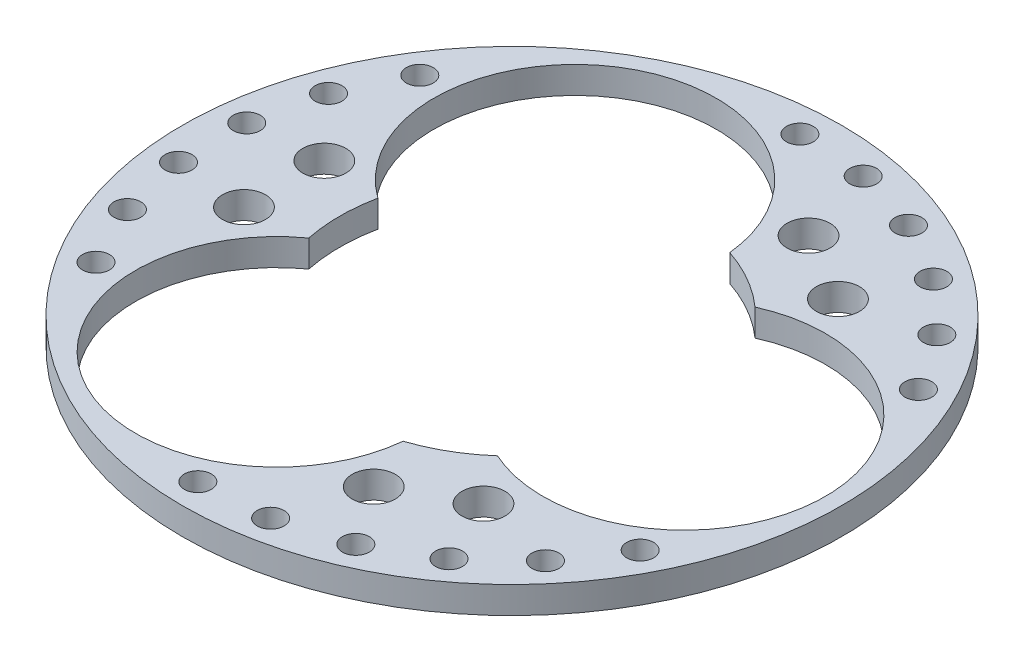
from build123d import *

# Parameters (mm, degrees)
SKETCH1_R           = 122.5
SKETCH1_R_2         = 5
SKETCH1_R_3         = 8
BOSS_EXTRUDE1_DEPTH = 10


with BuildPart() as part:
    # Sketch1 → Boss-Extrude1 (new body)
    with BuildSketch(Plane(origin=(0, 0, 0), x_dir=(1, 0, 0), z_dir=(0, 1, 0))):
        with Locations(Location((0.129975876, -0.519903504, 0), (0, 0, 270))):
            Circle(SKETCH1_R)
        with Locations(Location((-105.445871126, 36.866464731, 0), (0, 0, 270))):
            Circle(SKETCH1_R_2, mode=Mode.SUBTRACT)
        with Locations(Location((-111.15007196, 12.158856438, 0), (0, 0, 270))):
            Circle(SKETCH1_R_2, mode=Mode.SUBTRACT)
        with Locations(Location((-84.563490883, 14.413839776, 0), (0, 0, 270))):
            Circle(SKETCH1_R_3, mode=Mode.SUBTRACT)
        with Locations(Location((-84.563490883, -15.453646783, 0), (0, 0, 270))):
            Circle(SKETCH1_R_3, mode=Mode.SUBTRACT)
        with Locations(Location((-105.445871126, -37.906271738, 0), (0, 0, 270))):
            Circle(SKETCH1_R_2, mode=Mode.SUBTRACT)
        with Locations(Location((-111.15007196, -13.198663446, 0), (0, 0, 270))):
            Circle(SKETCH1_R_2, mode=Mode.SUBTRACT)
        with Locations(Location((-94.329866055, 59.657652631, 0), (0, 0, 270))):
            Circle(SKETCH1_R_2, mode=Mode.SUBTRACT)
        with Locations(Location((-4.755395509, 111.373497314, 0), (0, 0, 270))):
            Circle(SKETCH1_R_2, mode=Mode.SUBTRACT)
        with Locations(Location((20.540354731, 109.604646144, 0), (0, 0, 270))):
            Circle(SKETCH1_R_2, mode=Mode.SUBTRACT)
        with Locations(Location((-4.755395509, -112.413304321, 0), (0, 0, 270))):
            Circle(SKETCH1_R_2, mode=Mode.SUBTRACT)
        with Locations(Location((20.540354731, -110.644453151, 0), (0, 0, 270))):
            Circle(SKETCH1_R_2, mode=Mode.SUBTRACT)
        with Locations(Location((44.789871596, -103.230631835, 0), (0, 0, 270))):
            Circle(SKETCH1_R_2, mode=Mode.SUBTRACT)
        with Locations(Location((66.750127992, -90.551871893, 0), (0, 0, 270))):
            Circle(SKETCH1_R_2, mode=Mode.SUBTRACT)
        with Locations(Location((85.295444023, -73.258084917, 0), (0, 0, 270))):
            Circle(SKETCH1_R_2, mode=Mode.SUBTRACT)
        with Locations(Location((99.475189192, -52.235748186, 0), (0, 0, 270))):
            Circle(SKETCH1_R_2, mode=Mode.SUBTRACT)
        with Locations(Location((55.409710309, -66.399725612, 0), (0, 0, 270))):
            Circle(SKETCH1_R_3, mode=Mode.SUBTRACT)
        with Locations(Location((29.543708202, -81.333468891, 0), (0, 0, 270))):
            Circle(SKETCH1_R_3, mode=Mode.SUBTRACT)
        with Locations(Location((-94.329866055, -60.697459638, 0), (0, 0, 270))):
            Circle(SKETCH1_R_2, mode=Mode.SUBTRACT)
        with Locations(Location((29.543708202, 80.293661884, 0), (0, 0, 270))):
            Circle(SKETCH1_R_3, mode=Mode.SUBTRACT)
        with Locations(Location((55.409710309, 65.359918605, 0), (0, 0, 270))):
            Circle(SKETCH1_R_3, mode=Mode.SUBTRACT)
        with Locations(Location((99.475189192, 51.195941179, 0), (0, 0, 270))):
            Circle(SKETCH1_R_2, mode=Mode.SUBTRACT)
        with Locations(Location((85.295444023, 72.218277909, 0), (0, 0, 270))):
            Circle(SKETCH1_R_2, mode=Mode.SUBTRACT)
        with Locations(Location((66.750127992, 89.512064886, 0), (0, 0, 270))):
            Circle(SKETCH1_R_2, mode=Mode.SUBTRACT)
        with Locations(Location((44.789871596, 102.190824828, 0), (0, 0, 270))):
            Circle(SKETCH1_R_2, mode=Mode.SUBTRACT)
        with BuildLine():
            ThreePointArc((20.36256799, 60.197822214), (-58.120024124, 100.372056037), (-62.569413113, 12.317020601))
            ThreePointArc((-62.569413113, 12.317020601), (-63.870024124, -0.519903504), (-62.569413113, -13.356827608))
            ThreePointArc((-62.569413113, -13.356827608), (-58.120024124, -101.411863045), (20.36256799, -61.237629222))
            ThreePointArc((20.36256799, -61.237629222), (32.129975876, -55.945529346), (42.596772751, -48.400705117))
            ThreePointArc((42.596772751, -48.400705117), (116.629975876, -0.519903504), (42.596772751, 47.36089811))
            ThreePointArc((42.596772751, 47.36089811), (32.129975876, 54.905722339), (20.36256799, 60.197822214))
        make_face(mode=Mode.SUBTRACT)
    extrude(amount=BOSS_EXTRUDE1_DEPTH)


solid = part.part
